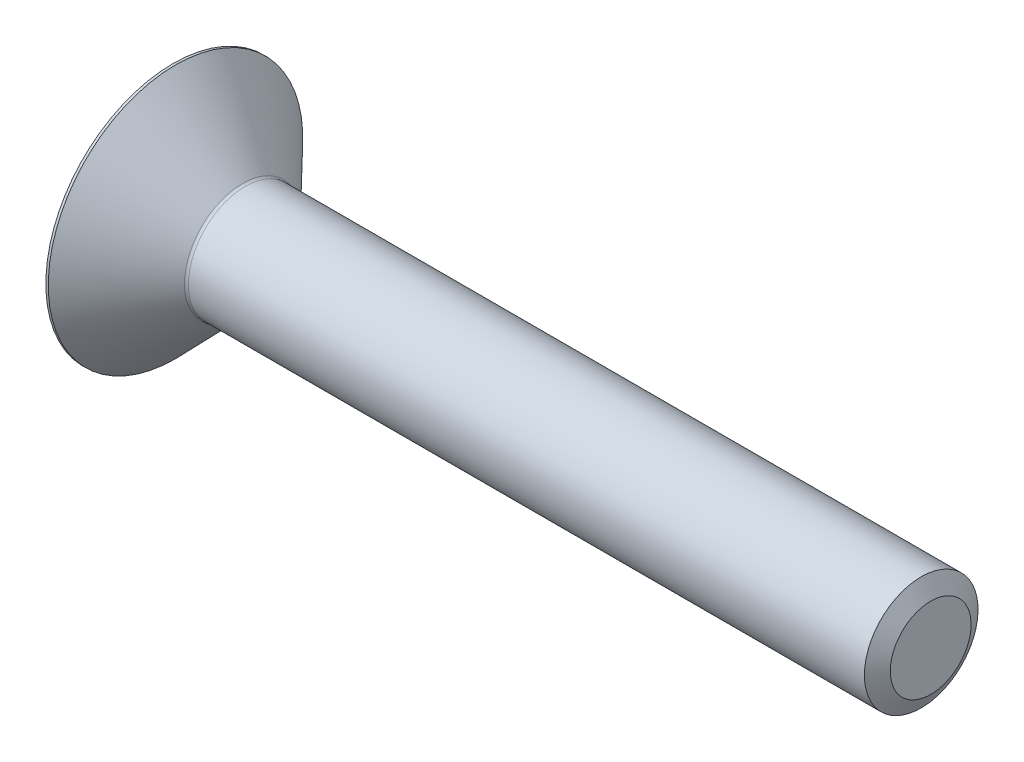
from build123d import *

# Parameters (mm, degrees)
CUT_EXTRUDE_1_DEPTH = 1.86


with BuildPart() as part:
    # 草图1 → 旋转1 (revolve)
    with BuildSketch(Plane.XY):
        with BuildLine():
            Line((0, 1.5), (-18.097552518, 1.5))
            ThreePointArc((-18.097552518, 1.5), (-18.136625631, 1.507949515), (-18.169486498, 1.530534163))
            Line((-18.169486498, 1.530534163), (-19.936181121, 3.36))
            Line((-19.936181121, 3.36), (-20, 3.36))
            Line((-20, 3.36), (-20, 0))
            Line((-20, 0), (0, 0))
            Line((0, 0), (0, 1.5))
        make_face()
    revolve(axis=Axis((0, 0, 0), (-1, 0, 0)))

    # 草图2 → 切除-拉伸1 (cut)
    with BuildSketch(Plane.ZY.offset(20)):
        Polygon((0, 1.154700538), (-1, 0.577350269), (-1, -0.577350269), (0, -1.154700538), (1, -0.577350269), (1, 0.577350269), align=None)
    extrude(amount=-CUT_EXTRUDE_1_DEPTH, mode=Mode.SUBTRACT)

    # 草图6 → 旋转2 (revolve)
    with BuildSketch(Plane.XY):
        Polygon((-18.9, 1.154700538), (-18.233333333, 0), (-17.84, 0), (-17.84, 1.154700538), align=None)
    revolve(axis=Axis((-20, 0, 0), (1, 0, 0)))

    # 草图7 → 切除-旋转2 (revolve, cut)
    with BuildSketch(Plane.XY):
        Polygon((-20, 1.154700538), (-20, 0), (-19.7, 0), align=None)
    revolve(axis=Axis((-20, 0, 0), (1, 0, 0)), mode=Mode.SUBTRACT)

    # 草图4 → 切除-旋转1 (revolve, cut)
    with BuildSketch(Plane.XY):
        Polygon((-0.25, 1.5), (0, 1.066987298), (0.25, 1.5), align=None)
    revolve(axis=Axis((-0.25, 0, 0), (1, 0, 0)), mode=Mode.SUBTRACT)


solid = part.part
